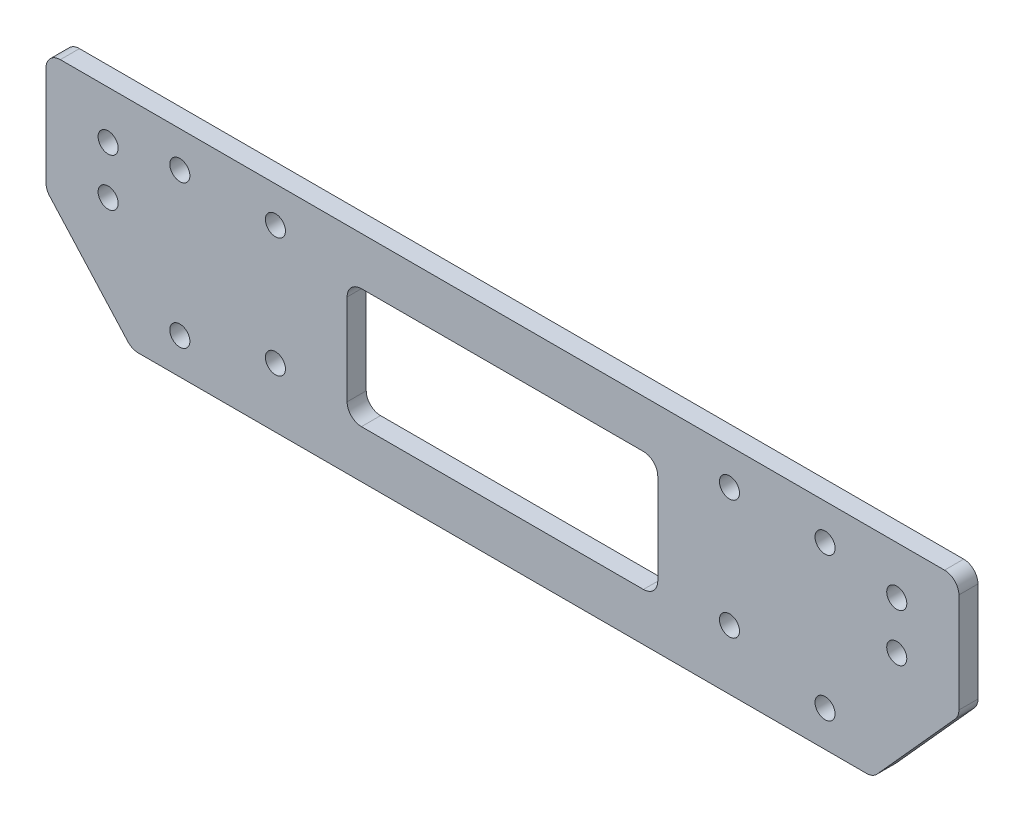
from build123d import *

# Parameters (mm, degrees)
SKETCH_1_W          = 155
SKETCH_1_H          = 45
SKETCH_1_R          = 2.1
EXTRUDE_1_DEPTH     = 4
SKETCH_2_W          = 65
SKETCH_2_H          = 25
CUT_EXTRUDE_1_DEPTH = 10
SKETCH_3_R          = 2.1
EXTRUDE_2_DEPTH     = 4
FILLET_1_R          = 3


with BuildPart() as part:
    # 草图1 → 凸台-拉伸1 (new body)
    with BuildSketch(Plane.XY):
        Rectangle(SKETCH_1_W, SKETCH_1_H)
        with Locations((-67.5, 15)):
            Circle(SKETCH_1_R, mode=Mode.SUBTRACT)
        with Locations((-67.5, -15)):
            Circle(SKETCH_1_R, mode=Mode.SUBTRACT)
        with Locations(Location((67.5, 15, 0), (0, 0, 180))):
            Circle(SKETCH_1_R, mode=Mode.SUBTRACT)
        with Locations(Location((67.5, -15, 0), (0, 0, 180))):
            Circle(SKETCH_1_R, mode=Mode.SUBTRACT)
        with Locations((-47.5, 15)):
            Circle(SKETCH_1_R, mode=Mode.SUBTRACT)
        with Locations((47.5, 15)):
            Circle(SKETCH_1_R, mode=Mode.SUBTRACT)
        with Locations((-47.5, -10)):
            Circle(SKETCH_1_R, mode=Mode.SUBTRACT)
        with Locations((47.5, -10)):
            Circle(SKETCH_1_R, mode=Mode.SUBTRACT)
    extrude(amount=EXTRUDE_1_DEPTH)

    # 草图2 → 切除-拉伸1 (cut)
    with BuildSketch(Plane.XY.offset(4)):
        Rectangle(SKETCH_2_W, SKETCH_2_H)
    extrude(amount=-CUT_EXTRUDE_1_DEPTH, mode=Mode.SUBTRACT)

    # 草图3 → 凸台-拉伸2 (add)
    # profile 1 of 2: a face of its own
    with BuildSketch(Plane.XY.offset(4)):
        Polygon((-77.5, 22.5), (-95.5, 22.5), (-95.5, -2.5), (-77.5, -22.5), align=None)
        with Locations((-82.5, 12.5)):
            Circle(SKETCH_3_R, mode=Mode.SUBTRACT)
        with Locations((-82.5, 2.5)):
            Circle(SKETCH_3_R, mode=Mode.SUBTRACT)
    # profile 2 of 2: a face of its own
    with BuildSketch(Plane.XY.offset(4)):
        Polygon((77.5, 22.5), (95.5, 22.5), (95.5, -2.5), (77.5, -22.5), align=None)
        with Locations(Location((82.5, 12.5, 0), (0, 0, 180))):
            Circle(SKETCH_3_R, mode=Mode.SUBTRACT)
        with Locations(Location((82.5, 2.5, 0), (0, 0, 180))):
            Circle(SKETCH_3_R, mode=Mode.SUBTRACT)
    extrude(amount=-EXTRUDE_2_DEPTH)

    # 圆角1
    fillet_1_edges = [part.edges().sort_by_distance(p)[0] for p in [
        (32.5, 12.5, 2),
        (32.5, -12.5, 2),
        (-32.5, -12.5, 2),
        (-32.5, 12.5, 2),
        (-95.5, -2.5, 2),
        (-95.5, 22.5, 2),
        (77.5, -22.5, 2),
        (-77.5, -22.5, 2),
        (95.5, 22.5, 2),
        (95.5, -2.5, 2),
    ]]
    fillet(fillet_1_edges, radius=FILLET_1_R)


solid = part.part
